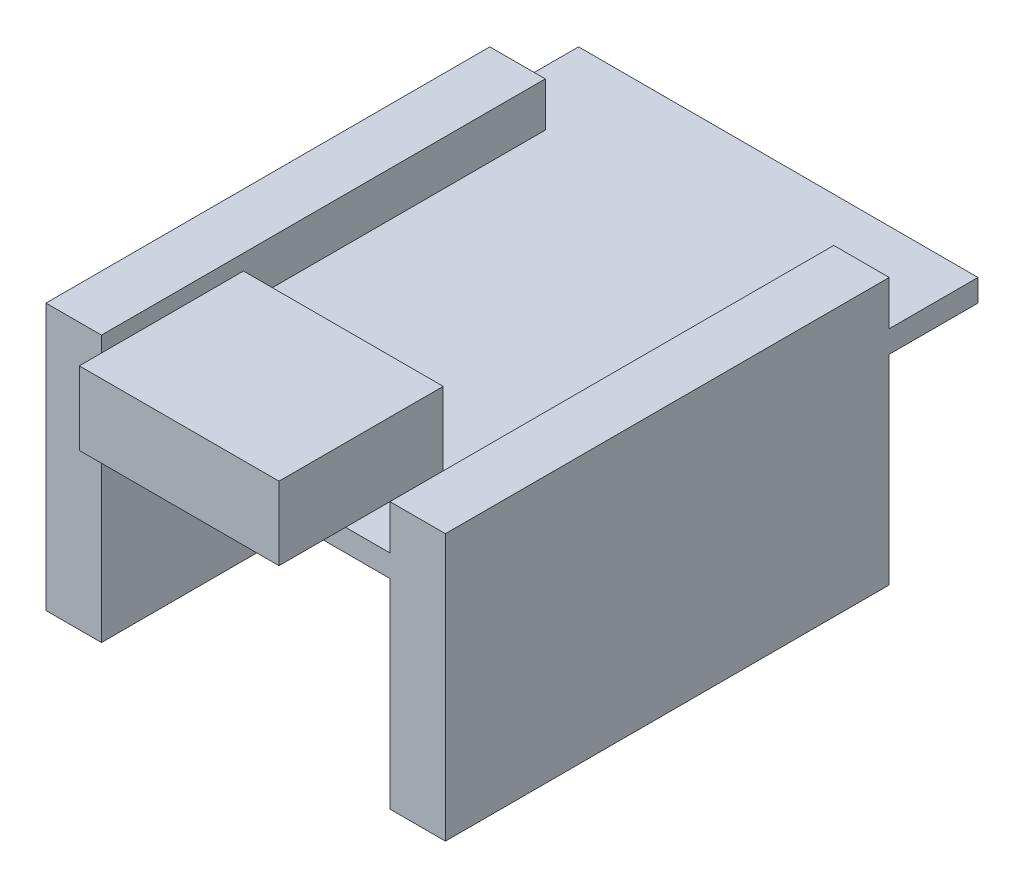
from build123d import *

# Parameters (mm, degrees)
SKETCH_1_W           = 18
SKETCH_1_H           = 24
EXTRUDE_1_DEPTH      = 1
SKETCH_2_W           = 9
SKETCH_2_H           = 7.4
EXTRUDE_2_DEPTH      = 3.3
EXTRUDE_3_DEPTH      = 9
EXTRUDE_3_DEPTH_BACK = 3
SKETCH_3_W           = 2.5
SKETCH_3_H           = 20


with BuildPart() as part:
    # 草图1 → 凸台-拉伸1 (new body)
    with BuildSketch(Plane(origin=(0, 0, 0), x_dir=(1, 0, 0), z_dir=(0, 1, 0))):
        Rectangle(SKETCH_1_W, SKETCH_1_H)
    extrude(amount=EXTRUDE_1_DEPTH)

    # 草图2 → 凸台-拉伸2 (add)
    with BuildSketch(Plane(origin=(0, 1, 0), x_dir=(1, 0, 0), z_dir=(0, 1, 0))):
        with Locations((0, -11.3)):
            Rectangle(SKETCH_2_W, SKETCH_2_H)
    extrude(amount=EXTRUDE_2_DEPTH)

    # 草图3 → 凸台-拉伸3 (add, two sides: drawn at the far end of the back side and taken through both)
    with BuildSketch(Plane.XZ.offset(-EXTRUDE_3_DEPTH_BACK)):
        with Locations((-7.75, 2)):
            Rectangle(SKETCH_3_W, SKETCH_3_H)
        with Locations((7.75, 2)):
            Rectangle(SKETCH_3_W, SKETCH_3_H)
    extrude(amount=EXTRUDE_3_DEPTH + EXTRUDE_3_DEPTH_BACK)


solid = part.part
